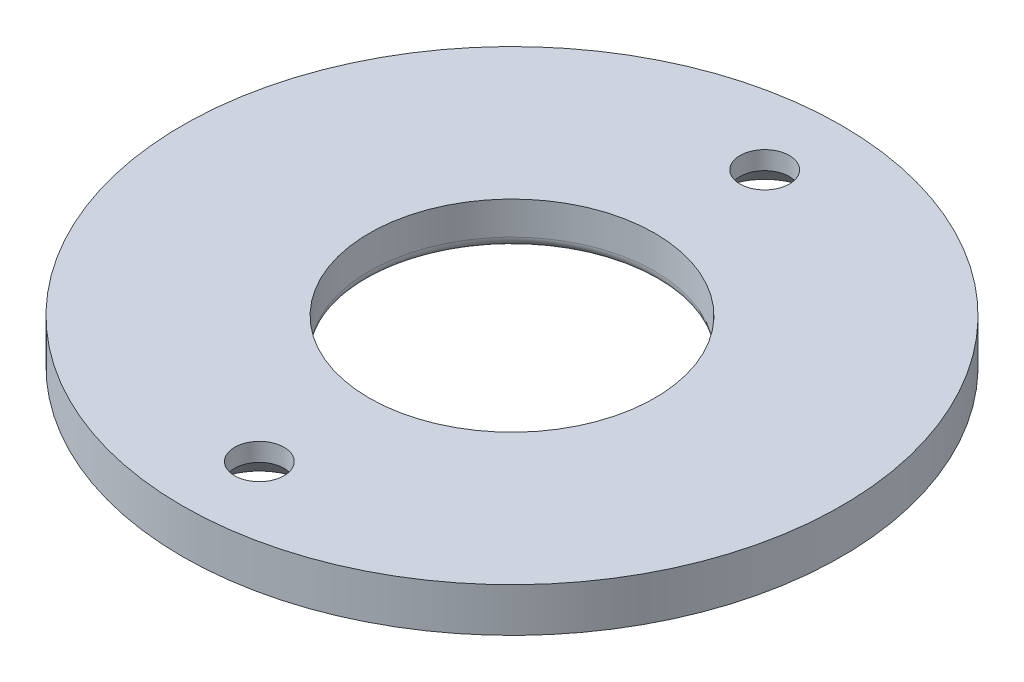
from build123d import *

# Parameters (mm, degrees)
CSK_FOR_M4_HEX_SOCKET_COUNTERSUNK_HE_2_COUNT = 2
CSK_FOR_M4_HEX_SOCKET_COUNTERSUNK_HE_2_PITCH = 46
FILLET1_R                                    = 1
CHAMFER1_SIZE                                = 0.5
SKETCH6_R                                    = 20.074468172
CUT_EXTRUDE2_DEPTH                           = 10


with BuildPart() as part:
    # Sketch1 → Revolve1 (revolve)
    with BuildSketch(Plane.XY, mode=Mode.PRIVATE) as revolve1_sk:
        Polygon((-30, -2), (-30, 2), (-16, 2), (-16, 4), (-13, 4), (-13, -2), align=None)
    revolve(revolve1_sk.sketch.rotate(Axis((0, 55, 0), (0, -1, 0)), 270), axis=Axis((0, 55, 0), (0, -1, 0)))

    # Sketch3 → CSK for M4 Hex Socket Countersunk Head Screw2 (revolve, cut)
    with BuildSketch(Plane(origin=(0, -2, 23), x_dir=(0, 0, -1), z_dir=(1, 0, 0))):
        Polygon((0, 0), (0, 4), (2.25, 4), (2.25, 2.34), (4.59, 0), align=None)
    csk_for_m4_hex_socket_countersunk_head_s = revolve(axis=Axis((0, -8.35, 23), (0, 1, 0)), mode=Mode.SUBTRACT)

    # CSK for M4 Hex Socket Countersunk He 2: CSK for M4 Hex Socket Countersunk Head Screw2 ×2
    with Locations(*[(0, 0, -i * CSK_FOR_M4_HEX_SOCKET_COUNTERSUNK_HE_2_PITCH) for i in range(1, CSK_FOR_M4_HEX_SOCKET_COUNTERSUNK_HE_2_COUNT)]):
        add(csk_for_m4_hex_socket_countersunk_head_s, mode=Mode.SUBTRACT)

    # Fillet1
    fillet1_edges = [part.edges().sort_by_distance(p)[0] for p in [
        (0, -2, -13),
    ]]
    fillet(fillet1_edges, radius=FILLET1_R)

    # Chamfer1
    chamfer1_edges = [part.edges().sort_by_distance(p)[0] for p in [
        (0, 4, -16),
    ]]
    chamfer(chamfer1_edges, length=CHAMFER1_SIZE)

    # Sketch6 → Cut-Extrude2 (cut)
    with BuildSketch(Plane(origin=(0, 2, 0), x_dir=(1, 0, 0), z_dir=(0, 1, 0))):
        Circle(SKETCH6_R)
    extrude(amount=CUT_EXTRUDE2_DEPTH, mode=Mode.SUBTRACT)


solid = part.part
